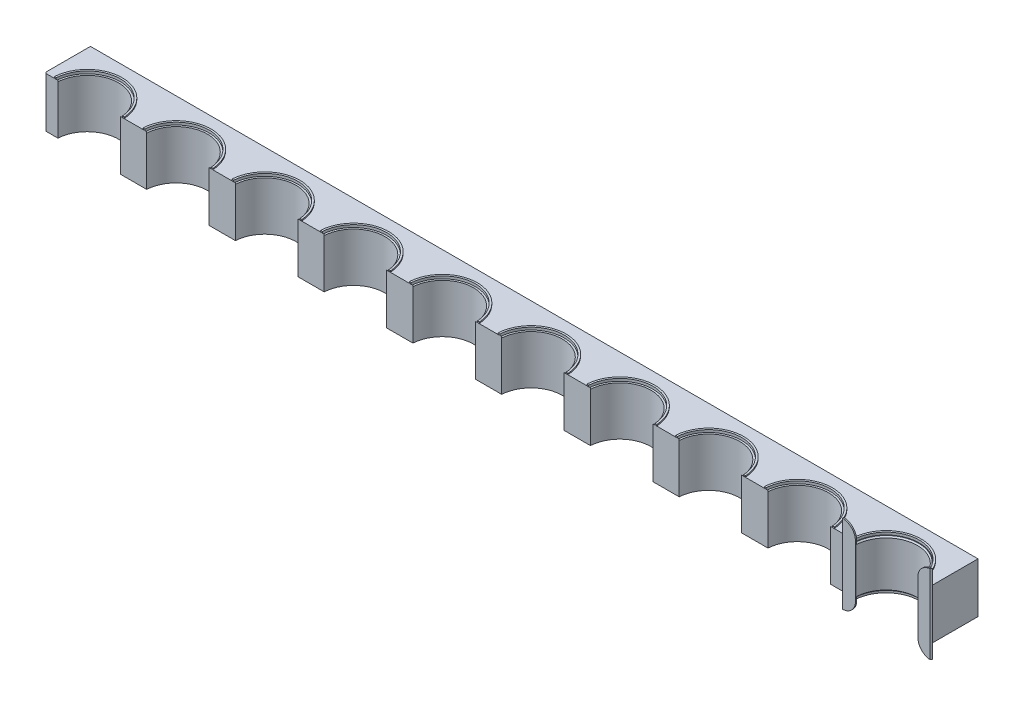
from build123d import *

# Parameters (mm, degrees)
BOSS_EXTRUDE1_DEPTH      = 101.6
CUT_EXTRUDE1_START       = -2.54
CUT_EXTRUDE1_DEPTH       = 2.54
BOSS_EXTRUDE2_DEPTH      = 2.54
CHAMFER2_SIZE            = 2.54
BOSS_EXTRUDE5_DEPTH      = 2.54
CHAMFER2_OF_MIRROR1_SIZE = 2.54
MIRROR3_COPY_1_DEPTH     = 2.54
MIRROR3_COPY_2_DEPTH     = 2.54
LPATTERN14_COUNT         = 10
LPATTERN14_PITCH         = 180.086
CHAMFER3_SIZE            = 2.54
CHAMFER4_SIZE            = 2.54


with BuildPart() as part:
    # Sketch1 → Boss-Extrude1 (new body)
    with BuildSketch(Plane(origin=(0, 0, 0), x_dir=(1, 0, 0), z_dir=(0, 1, 0))):
        with BuildLine():
            Line((63.390989336, 0), (90.060989336, 0))
            Line((90.060989336, 0), (90.060989336, 95.25))
            Line((90.060989336, 95.25), (-90.060989336, 95.25))
            Line((-90.060989336, 95.25), (-90.060989336, 0))
            Line((-90.060989336, 0), (-63.390989336, 0))
            ThreePointArc((-63.390989336, 0), (0, 59.780796989), (63.390989336, 0))
        make_face()
    boss_extrude1 = extrude(amount=BOSS_EXTRUDE1_DEPTH)

    # Sketch2 → Cut-Extrude1 (cut)
    with BuildSketch(Plane(origin=(0, 101.6, 0), x_dir=(1, 0, 0), z_dir=(0, 1, 0)).offset(CUT_EXTRUDE1_START)):
        with BuildLine():
            Line((67.194448696, 0.223152181), (63.390989336, 0))
            ThreePointArc((63.390989336, 0), (0, 59.780796989), (-63.390989336, 0))
            Line((-63.390989336, 0), (-67.194448696, 0.223152181))
            ThreePointArc((-67.194448696, 0.223152181), (0, 63.590796989), (67.194448696, 0.223152181))
        make_face()
    cut_extrude1 = extrude(amount=CUT_EXTRUDE1_DEPTH, mode=Mode.SUBTRACT)

    # Sketch3 → Boss-Extrude2 (add)
    with BuildSketch(Plane(origin=(0, 101.6, 0), x_dir=(1, 0, 0), z_dir=(0, 1, 0))):
        with BuildLine():
            Line((-70.997908056, 0.446304361), (-67.194448696, 0.223152181))
            ThreePointArc((-67.194448696, 0.223152181), (0, 63.590796989), (67.194448696, 0.223152181))
            Line((67.194448696, 0.223152181), (70.997908056, 0.446304361))
            ThreePointArc((70.997908056, 0.446304361), (0, 67.400796989), (-70.997908056, 0.446304361))
        make_face()
    boss_extrude2 = extrude(amount=BOSS_EXTRUDE2_DEPTH)

    # Chamfer2
    chamfer2_edges = [part.edges().sort_by_distance(p)[0] for p in [
        (0, 99.06, -59.780796989),
    ]]
    chamfer(chamfer2_edges, length=CHAMFER2_SIZE)

    # Sketch4 → Boss-Extrude5 (add)
    with BuildSketch(Plane.XY):
        with BuildLine():
            Line((-90.060989336, 50.8), (-63.390989336, 50.8))
            Line((-63.390989336, 50.8), (-63.390989336, 104.14))
            ThreePointArc((-63.390989336, 104.14), (-71.202451482, 122.998537854), (-90.060989336, 130.81))
            Line((-90.060989336, 130.81), (-90.060989336, 50.8))
        make_face()
    boss_extrude5 = extrude(amount=BOSS_EXTRUDE5_DEPTH)

    # Mirror1: Cut-Extrude1, Boss-Extrude2, Boss-Extrude5 across plane
    add(cut_extrude1.mirror(Plane.ZX.offset(50.8)), mode=Mode.SUBTRACT)
    add(boss_extrude2.mirror(Plane.ZX.offset(50.8)))
    add(boss_extrude5.mirror(Plane.ZX.offset(50.8)))

    # Chamfer2 of Mirror1
    chamfer2_of_mirror1_edges = [part.edges().sort_by_distance(p)[0] for p in [
        (0, 2.54, -59.780796989),
    ]]
    chamfer(chamfer2_of_mirror1_edges, length=CHAMFER2_OF_MIRROR1_SIZE)

    # Mirror2: Boss-Extrude5 across plane
    add(boss_extrude5.mirror(Plane(origin=(0, 0, 0), x_dir=(0, 0, 1), z_dir=(1, 0, 0))))

    # Mirror3 copy 1 sketch → Mirror3 copy 1 (add)
    with BuildSketch(Plane(origin=(0, 101.6, 0), x_dir=(-1, 0, 0), z_dir=(0, 0, 1))):
        with BuildLine():
            Line((-90.060989336, 50.8), (-63.390989336, 50.8))
            Line((-63.390989336, 50.8), (-63.390989336, 104.14))
            ThreePointArc((-63.390989336, 104.14), (-71.202451482, 122.998537854), (-90.060989336, 130.81))
            Line((-90.060989336, 130.81), (-90.060989336, 50.8))
        make_face()
    extrude(amount=MIRROR3_COPY_1_DEPTH)

    # Mirror3 copy 2 sketch → Mirror3 copy 2 (add)
    with BuildSketch(Plane(origin=(0, 101.6, 0), x_dir=(1, 0, 0), z_dir=(0, 0, 1))):
        with BuildLine():
            Line((-90.060989336, -50.8), (-63.390989336, -50.8))
            Line((-63.390989336, -50.8), (-63.390989336, -104.14))
            ThreePointArc((-63.390989336, -104.14), (-71.202451482, -122.998537854), (-90.060989336, -130.81))
            Line((-90.060989336, -130.81), (-90.060989336, -50.8))
        make_face()
    extrude(amount=MIRROR3_COPY_2_DEPTH)

    # LPattern14: Boss-Extrude1, Cut-Extrude1, Boss-Extrude2 ×10
    with Locations(*[(-i * LPATTERN14_PITCH, 0, 0) for i in range(1, LPATTERN14_COUNT)]):
        add(boss_extrude1)
        add(cut_extrude1, mode=Mode.SUBTRACT)
        add(boss_extrude2)

    # Chamfer3
    chamfer3_edges = [part.edges().sort_by_distance(p)[0] for p in [
        (-810.387, 101.6, -95.25),
    ]]
    chamfer(chamfer3_edges, length=CHAMFER3_SIZE)

    # Chamfer4
    chamfer4_edges = [part.edges().sort_by_distance(p)[0] for p in [
        (90.060989336, 50.8, 2.54),
        (-1710.834989336, 50.8, 0),
        (90.060989336, 49.53, -95.25),
        (-810.387, 0, -95.25),
    ]]
    chamfer(chamfer4_edges, length=CHAMFER4_SIZE)


solid = part.part
